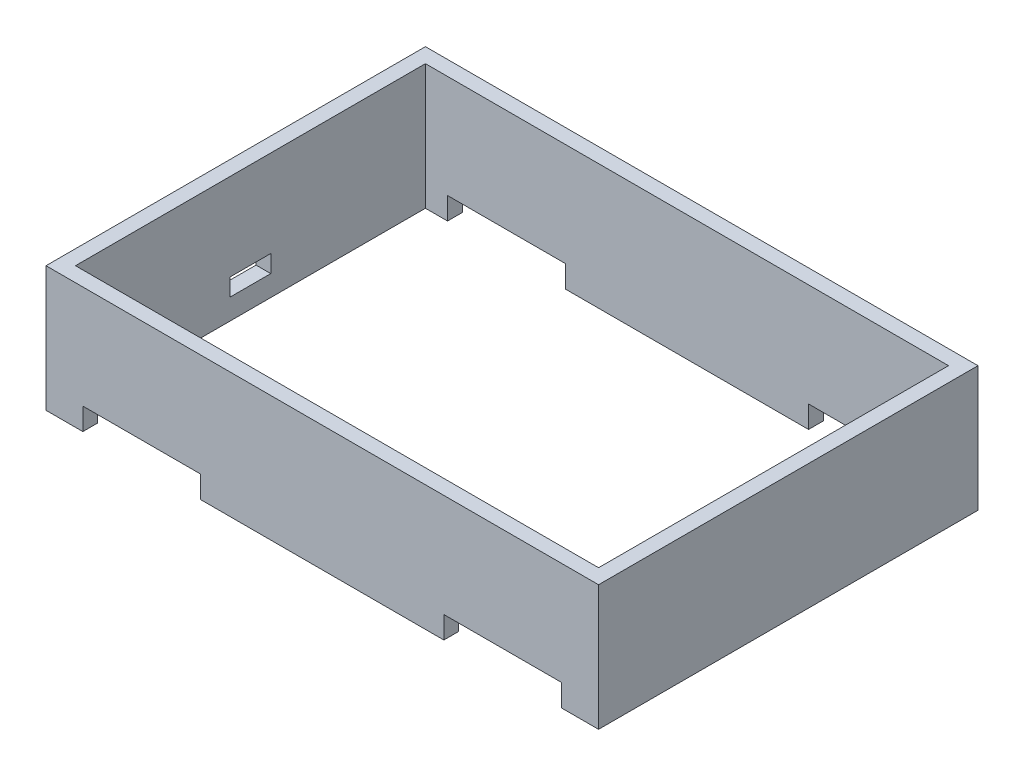
from build123d import *

# Parameters (mm, degrees)
SKETCH1_W               = 95.25
SKETCH1_H               = 65.405
BOSS_EXTRUDE1_DEPTH     = 21.59
SKETCH2_W               = 90.17
SKETCH2_H               = 60.325
CUT_EXTRUDE1_DEPTH      = 21.59
CUT_EXTRUDE2_REACH      = 104.996
SKETCH3_W               = 7
SKETCH3_H               = 3
CUT_EXTRUDE3_DEPTH      = 84.738179763
CUT_EXTRUDE3_DEPTH_BACK = 84.738179763
SKETCH4_W               = 20.32
SKETCH4_H               = 3.81


with BuildPart() as part:
    # Sketch1 → Boss-Extrude1 (new body)
    with BuildSketch(Plane(origin=(0, 0, 0), x_dir=(1, 0, 0), z_dir=(0, 1, 0))):
        Rectangle(SKETCH1_W, SKETCH1_H)
    extrude(amount=BOSS_EXTRUDE1_DEPTH)

    # Sketch2 → Cut-Extrude1 (cut)
    with BuildSketch(Plane(origin=(0, 21.59, 0), x_dir=(1, 0, 0), z_dir=(0, 1, 0))):
        Rectangle(SKETCH2_W, SKETCH2_H)
    extrude(amount=-CUT_EXTRUDE1_DEPTH, mode=Mode.SUBTRACT)

    # Sketch3 → Cut-Extrude2 (cut, up to next)
    with BuildSketch(Plane.ZY.offset(47.625), mode=Mode.PRIVATE) as cut_extrude2_sk1:
        with Locations((0, 5.08)):
            Rectangle(SKETCH3_W, SKETCH3_H)
    cut_extrude2_tool1 = extrude(cut_extrude2_sk1.sketch, amount=-CUT_EXTRUDE2_REACH, mode=Mode.PRIVATE) & part.part
    add(cut_extrude2_tool1.solids().sort_by_distance((-47.625, 5.08, 0))[0], mode=Mode.SUBTRACT)

    # Sketch4 → Cut-Extrude3 (cut, two sides: drawn at the far end of the back side and taken through both)
    with BuildSketch(Plane(origin=(0, 0, -32.7025), x_dir=(-1, 0, 0), z_dir=(0, 0, -1)).offset(-CUT_EXTRUDE3_DEPTH_BACK)):
        with Locations((-31.115, 1.905)):
            Rectangle(SKETCH4_W, SKETCH4_H)
        with Locations((31.115, 1.905)):
            Rectangle(SKETCH4_W, SKETCH4_H)
    extrude(amount=CUT_EXTRUDE3_DEPTH + CUT_EXTRUDE3_DEPTH_BACK, mode=Mode.SUBTRACT)


solid = part.part
